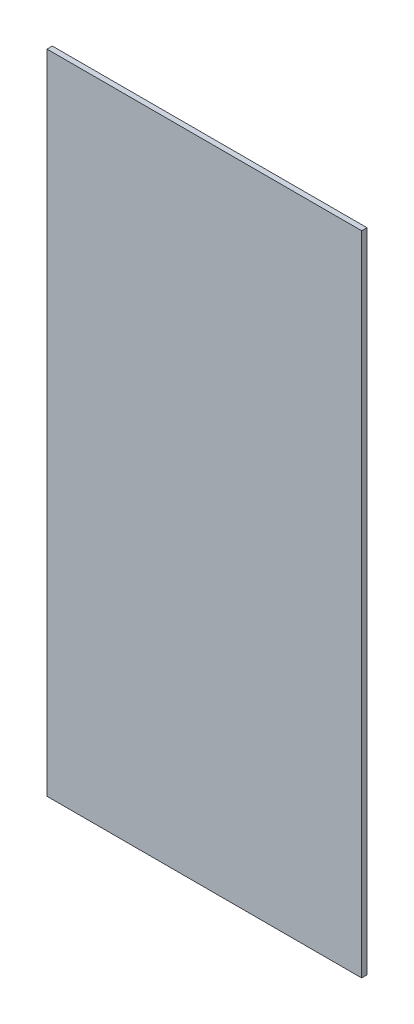
from build123d import *

# Parameters (mm, degrees)
SKETCH1_W           = 890
SKETCH1_H           = 1830
BOSS_EXTRUDE1_DEPTH = 15


with BuildPart() as part:
    # Sketch1 → Boss-Extrude1 (new body)
    with BuildSketch(Plane.XY):
        with Locations((445, 915)):
            Rectangle(SKETCH1_W, SKETCH1_H)
    extrude(amount=BOSS_EXTRUDE1_DEPTH)


solid = part.part
